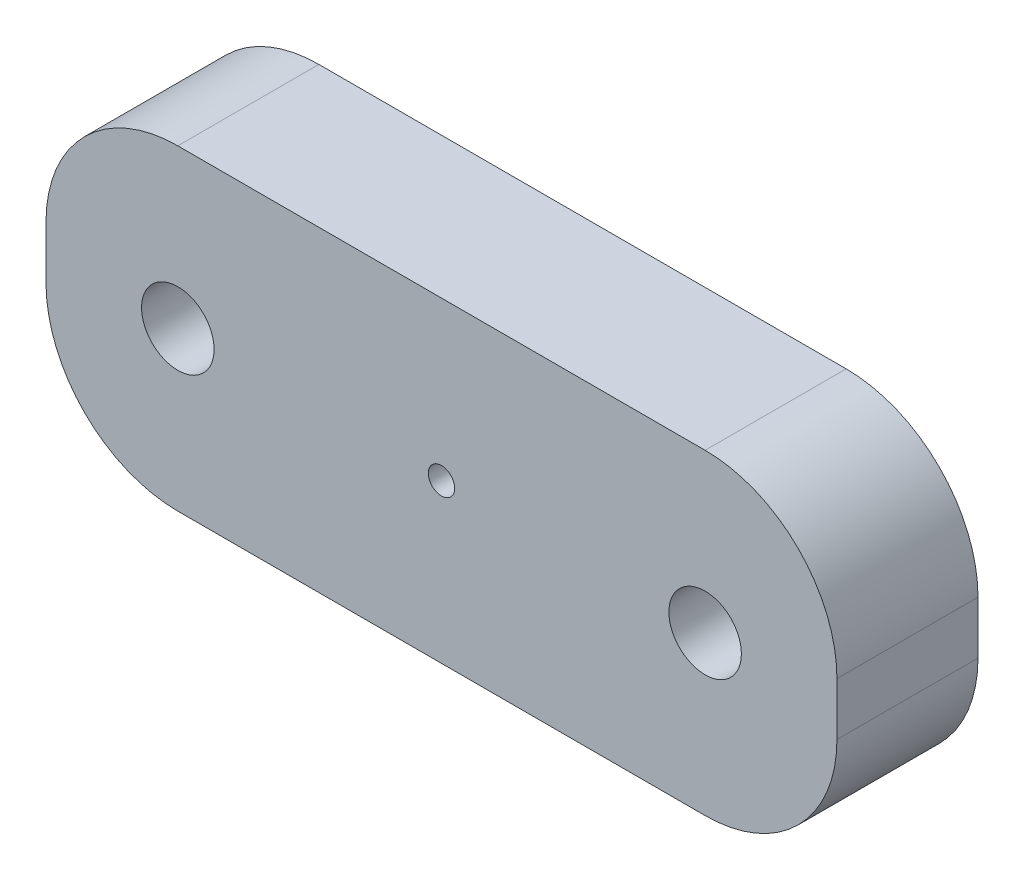
from build123d import *

# Parameters (mm, degrees)
MODEL_R             = 1.375
MODEL_R_2           = 0.5
BOSS_EXTRUDE1_DEPTH = 5.35


with BuildPart() as part:
    # Model → Boss-Extrude1 (new body)
    with BuildSketch(Plane.XY):
        with BuildLine():
            Line((5, 0), (24.999999441, 0))
            ThreePointArc((24.999999441, 0), (28.535533275, 1.464466134), (29.999999329, 5))
            Line((29.999999329, 5), (29.999999329, 7.0000001))
            ThreePointArc((29.999999329, 7.0000001), (28.535533237, 10.535534009), (24.999999329, 12.000000104))
            Line((24.999999329, 12.000000104), (4.999999888, 12.000000104))
            ThreePointArc((4.999999888, 12.000000104), (1.464466055, 10.535533971), (0, 7.000000104))
            Line((0, 7.000000104), (0, 5.000000005))
            ThreePointArc((0, 5.000000005), (1.464466092, 1.464466096), (5, 0))
        make_face()
        with Locations((4.999999665, 6.000000052)):
            Circle(MODEL_R, mode=Mode.SUBTRACT)
        with Locations((24.999999665, 6.000000052)):
            Circle(MODEL_R, mode=Mode.SUBTRACT)
        with Locations((14.999999665, 6.000000052)):
            Circle(MODEL_R_2, mode=Mode.SUBTRACT)
    extrude(amount=BOSS_EXTRUDE1_DEPTH)


solid = part.part
